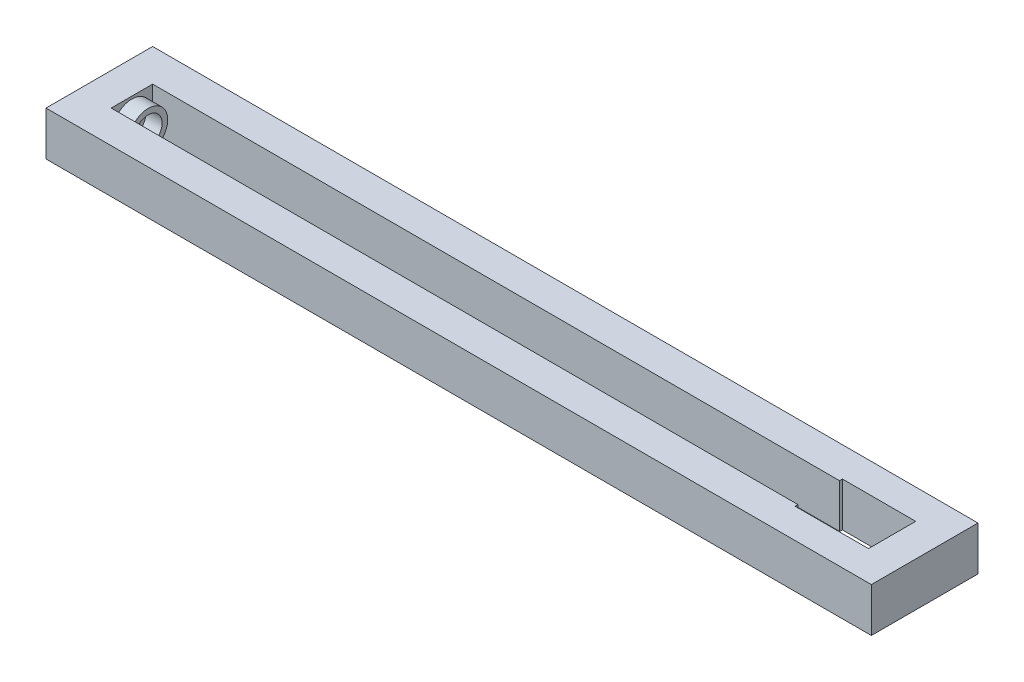
from build123d import *

# Parameters (mm, degrees)
SKETCH1_W           = 760
SKETCH1_H           = 98.2
SKETCH1_W_2         = 700
SKETCH1_H_2         = 38.2
BOSS_EXTRUDE3_DEPTH = 40.64
SKETCH2_W           = 700
SKETCH2_H           = 38.2
BOSS_EXTRUDE4_DEPTH = 0.254
SKETCH3_W           = 67.5
SKETCH3_H           = 43.5
CUT_EXTRUDE1_DEPTH  = 40.386
CUT_EXTRUDE5_REACH  = 387.308
SKETCH5_W           = 67.5
SKETCH5_H           = 43.5
SKETCH6_R           = 18
SKETCH6_R_2         = 12.8397
BOSS_EXTRUDE5_DEPTH = 15


with BuildPart() as part:
    # Sketch1 → Boss-Extrude3 (new body)
    with BuildSketch(Plane(origin=(0, 0, 0), x_dir=(1, 0, 0), z_dir=(0, 1, 0))):
        Rectangle(SKETCH1_W, SKETCH1_H)
        Rectangle(SKETCH1_W_2, SKETCH1_H_2, mode=Mode.SUBTRACT)
    extrude(amount=BOSS_EXTRUDE3_DEPTH)

    # Sketch2 → Boss-Extrude4 (add)
    with BuildSketch(Plane.XZ):
        Rectangle(SKETCH2_W, SKETCH2_H)
    extrude(amount=-BOSS_EXTRUDE4_DEPTH)

    # Sketch3 → Cut-Extrude1 (cut)
    with BuildSketch(Plane(origin=(0, 40.64, 0), x_dir=(1, 0, 0), z_dir=(0, 1, 0))):
        with Locations((316.25, 0)):
            Rectangle(SKETCH3_W, SKETCH3_H)
    extrude(amount=-CUT_EXTRUDE1_DEPTH, mode=Mode.SUBTRACT)

    # Sketch5 → Cut-Extrude5 (cut, up to next)
    with BuildSketch(Plane(origin=(0, 40.64, 0), x_dir=(1, 0, 0), z_dir=(0, 1, 0)), mode=Mode.PRIVATE) as cut_extrude5_sk1:
        with Locations((316.25, 0)):
            Rectangle(SKETCH5_W, SKETCH5_H)
    cut_extrude5_tool1 = extrude(cut_extrude5_sk1.sketch, amount=-CUT_EXTRUDE5_REACH, mode=Mode.PRIVATE) & part.part
    add(cut_extrude5_tool1.solids().sort_by_distance((316.25, 40.64, 0))[0], mode=Mode.SUBTRACT)

    # Sketch6 → Boss-Extrude5 (add)
    with BuildSketch(Plane(origin=(-350, 0, 0), x_dir=(0, 0, -1), z_dir=(1, 0, 0))):
        with Locations((0, 20.32)):
            Circle(SKETCH6_R)
        with Locations((0, 20.32)):
            Circle(SKETCH6_R_2, mode=Mode.SUBTRACT)
    extrude(amount=BOSS_EXTRUDE5_DEPTH)


solid = part.part
